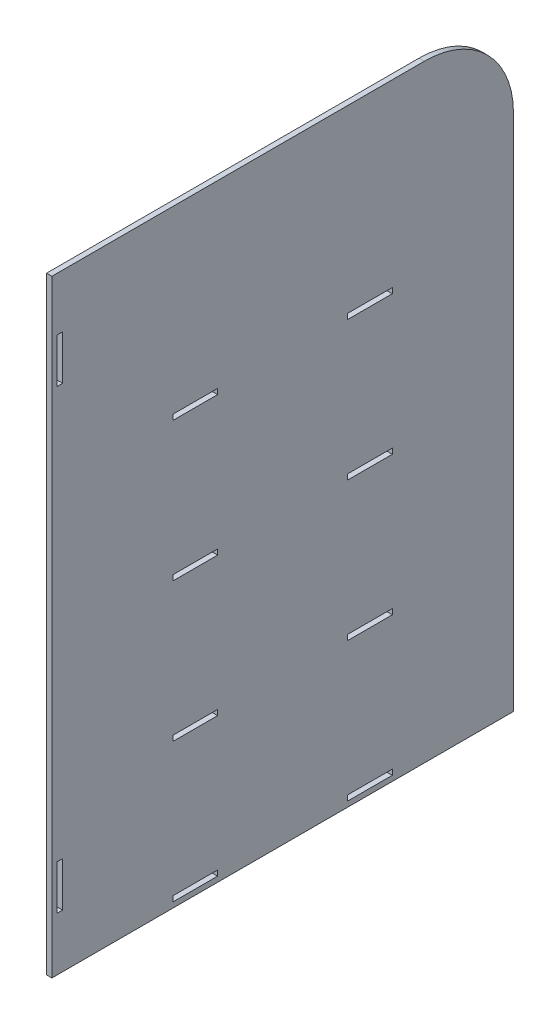
from build123d import *

# Parameters (mm, degrees)
SKETCH1_W           = 6
SKETCH1_H           = 50
SKETCH1_W_2         = 50
SKETCH1_H_2         = 6
BOSS_EXTRUDE1_DEPTH = 6


with BuildPart() as part:
    # Sketch1 → Boss-Extrude1 (new body)
    with BuildSketch(Plane(origin=(0, 0, 0), x_dir=(0, 0, -1), z_dir=(1, 0, 0))):
        with BuildLine():
            Line((-396.831767264, 339.151199882), (21.168232736, 339.151199882))
            ThreePointArc((21.168232736, 339.151199882), (91.878910855, 309.861878001), (121.168232736, 239.151199882))
            Line((121.168232736, 239.151199882), (121.168232736, -342.848800118))
            Line((121.168232736, -342.848800118), (-396.831767264, -342.848800118))
            Line((-396.831767264, -342.848800118), (-396.831767264, 339.151199882))
        make_face()
        with Locations((-387.831767264, 254.151199882)):
            Rectangle(SKETCH1_W, SKETCH1_H, mode=Mode.SUBTRACT)
        with Locations((-387.831767264, -257.848800118)):
            Rectangle(SKETCH1_W, SKETCH1_H, mode=Mode.SUBTRACT)
        with Locations((-235.831767264, -333.848800118)):
            Rectangle(SKETCH1_W_2, SKETCH1_H_2, mode=Mode.SUBTRACT)
        with Locations((-39.831767264, -333.848800118)):
            Rectangle(SKETCH1_W_2, SKETCH1_H_2, mode=Mode.SUBTRACT)
        with Locations((-235.831767264, -177.848800118)):
            Rectangle(SKETCH1_W_2, SKETCH1_H_2, mode=Mode.SUBTRACT)
        with Locations((-39.831767264, -177.848800118)):
            Rectangle(SKETCH1_W_2, SKETCH1_H_2, mode=Mode.SUBTRACT)
        with Locations((-235.831767264, -21.848800118)):
            Rectangle(SKETCH1_W_2, SKETCH1_H_2, mode=Mode.SUBTRACT)
        with Locations((-39.831767264, -21.848800118)):
            Rectangle(SKETCH1_W_2, SKETCH1_H_2, mode=Mode.SUBTRACT)
        with Locations((-235.831767264, 134.151199882)):
            Rectangle(SKETCH1_W_2, SKETCH1_H_2, mode=Mode.SUBTRACT)
        with Locations((-39.831767264, 134.151199882)):
            Rectangle(SKETCH1_W_2, SKETCH1_H_2, mode=Mode.SUBTRACT)
    extrude(amount=BOSS_EXTRUDE1_DEPTH)


solid = part.part
